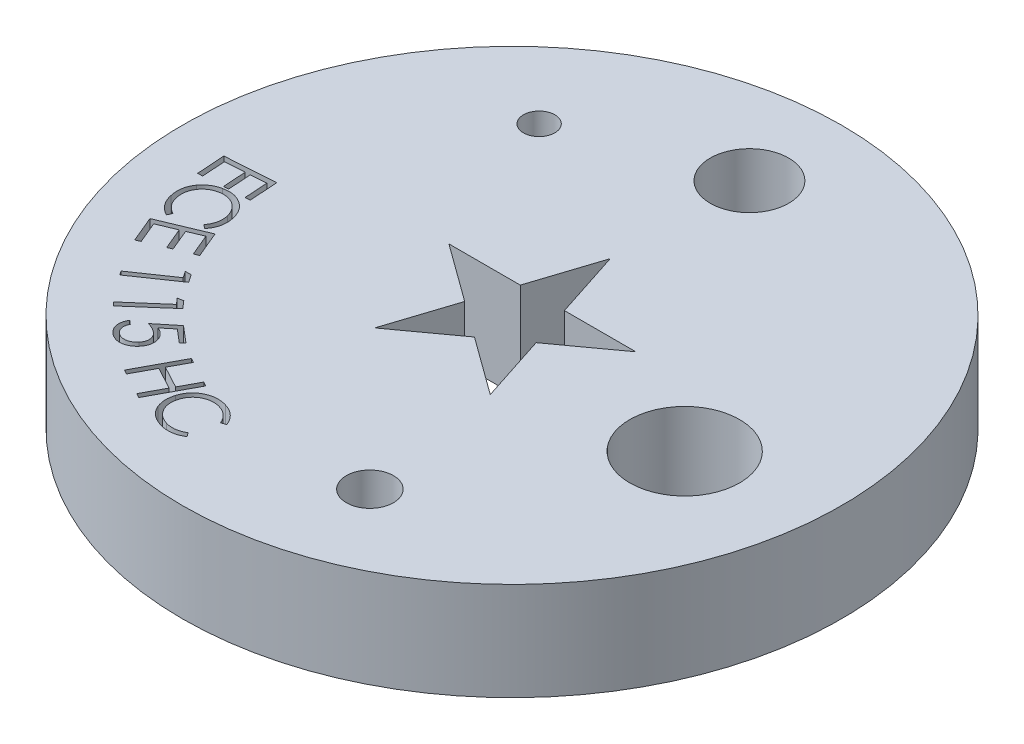
from build123d import *

# Parameters (mm, degrees)
SKETCH1_R           = 21
BOSS_EXTRUDE1_DEPTH = 6.25
CUT_EXTRUDE1_DEPTH  = 31.349011516
SKETCH3_R           = 1
CUT_EXTRUDE2_DEPTH  = 31.349011516
SKETCH5_R           = 2.5
CUT_EXTRUDE3_DEPTH  = 31.349011516
SKETCH6_R           = 3.5
CUT_EXTRUDE4_DEPTH  = 31.349011516
SKETCH7_R           = 1.5
CUT_EXTRUDE5_DEPTH  = 31.349011516
CUT_EXTRUDE6_DEPTH  = 31.349011516


with BuildPart() as part:
    # Sketch1 → Boss-Extrude1 (new body)
    with BuildSketch(Plane(origin=(0, 0, 0), x_dir=(1, 0, 0), z_dir=(0, 1, 0))):
        with Locations(Location((0, 0, 0), (0, 0, 270))):
            Circle(SKETCH1_R)
    extrude(amount=BOSS_EXTRUDE1_DEPTH)

    # Sketch2 → Cut-Extrude1 (cut, through all)
    with BuildSketch(Plane(origin=(0, 6.25, 0), x_dir=(1, 0, 0), z_dir=(0, 1, 0))):
        Polygon((0, 6.260990337), (-1.405679911, 1.934752416), (-5.954555658, 1.934752416), (-2.274437874, -0.739009663), (-3.680117785, -5.065247584), (0, -2.391485505), (3.680117785, -5.065247584), (2.274437874, -0.739009663), (5.954555658, 1.934752416), (1.405679911, 1.934752416), align=None)
    extrude(amount=-CUT_EXTRUDE1_DEPTH, mode=Mode.SUBTRACT)

    # Sketch3 → Cut-Extrude2 (cut, through all)
    with BuildSketch(Plane(origin=(0, 6.25, 0), x_dir=(1, 0, 0), z_dir=(0, 1, 0))):
        with Locations(Location((-9.706719743, 11.435890513, 0), (0, 0, 270))):
            Circle(SKETCH3_R)
    extrude(amount=-CUT_EXTRUDE2_DEPTH, mode=Mode.SUBTRACT)

    # Sketch5 → Cut-Extrude3 (cut, through all)
    with BuildSketch(Plane(origin=(0, 6.25, 0), x_dir=(1, 0, 0), z_dir=(0, 1, 0))):
        with Locations(Location((0.131567891, 15, 0), (0, 0, 270))):
            Circle(SKETCH5_R)
    extrude(amount=-CUT_EXTRUDE3_DEPTH, mode=Mode.SUBTRACT)

    # Sketch6 → Cut-Extrude4 (cut, through all)
    with BuildSketch(Plane(origin=(0, 6.25, 0), x_dir=(1, 0, 0), z_dir=(0, 1, 0))):
        with Locations(Location((13, -1.994916639, 0), (0, 0, 270))):
            Circle(SKETCH6_R)
    extrude(amount=-CUT_EXTRUDE4_DEPTH, mode=Mode.SUBTRACT)

    # Sketch7 → Cut-Extrude5 (cut, through all)
    with BuildSketch(Plane(origin=(0, 6.25, 0), x_dir=(1, 0, 0), z_dir=(0, 1, 0))):
        with Locations(Location((5.064482164, -14.119172086, 0), (0, 0, 270))):
            Circle(SKETCH7_R)
    extrude(amount=-CUT_EXTRUDE5_DEPTH, mode=Mode.SUBTRACT)

    # Sketch8 → Cut-Extrude6 (cut, through all)
    with BuildSketch(Plane(origin=(0, 6.25, 0), x_dir=(1, 0, 0), z_dir=(0, 1, 0))):
        Polygon((-14.816731771, -0.176812901), (-14.696524439, -1.986283053), (-15.008173077, -2.007271635), (-15.107391827, -0.513266226), (-16.094491186, -0.578776042), (-15.995908454, -2.05942508), (-16.305013021, -2.079777644), (-16.403595753, -0.599128606), (-17.642558093, -0.681810897), (-17.543975361, -2.162459936), (-17.854987981, -2.1828125), (-17.974559295, -0.386698718), align=None)
        with BuildLine():
            Line((-14.58696148, -5.001461761), (-14.829284196, -4.803024261))
            add(Edge.make_bspline(
                [(-14.829284196, -4.803024261), (-14.812098196, -4.781145379), (-14.777872061, -4.737573309), (-14.730947732, -4.669749255), (-14.688743726, -4.600051143), (-14.651269781, -4.528843323), (-14.618191342, -4.456208832), (-14.589145087, -4.38228198), (-14.565972037, -4.306189004), (-14.539487678, -4.203152787), (-14.51808037, -4.071046811), (-14.51245312, -3.909537234), (-14.522878977, -3.744821569), (-14.545546194, -3.635944172), (-14.557068651, -3.58059838)],
                knots=[0, 0, 0, 0, 0.770714165, 1.534886924, 2.283366767, 3.026944255, 3.762942943, 4.493790365, 5.225793501, 5.965183097, 7.440738967, 8.922129034, 10.435421736, 12, 12, 12, 12], degree=3))
            add(Edge.make_bspline(
                [(-14.557068651, -3.58059838), (-14.564729189, -3.550380779), (-14.579921014, -3.490455418), (-14.60956072, -3.403007698), (-14.643987282, -3.318604955), (-14.682424429, -3.236457128), (-14.72807114, -3.158600322), (-14.77778562, -3.083093006), (-14.832435917, -3.010509309), (-14.892250438, -2.941568418), (-14.955272676, -2.876069153), (-15.02238592, -2.816372175), (-15.091755269, -2.761454403), (-15.163817496, -2.711817448), (-15.238306758, -2.666836709), (-15.316189588, -2.628350687), (-15.396475999, -2.594144771), (-15.479828962, -2.566666143), (-15.564627115, -2.543456182), (-15.650998213, -2.527034396), (-15.738102669, -2.516256091), (-15.826276454, -2.510940477), (-15.91552953, -2.512463653), (-16.005981208, -2.51959631), (-16.09767074, -2.531872474), (-16.15843127, -2.545354899), (-16.189089885, -2.552157875)],
                knots=[0, 0, 0, 0, 1.042613934, 2.067636623, 3.085765015, 4.091464616, 5.098788632, 6.102059215, 7.114911589, 8.135803287, 9.154030498, 10.153608741, 11.138381355, 12.112263656, 13.079303243, 14.046758917, 15.016292351, 15.996456499, 16.98059034, 17.955711611, 18.934874399, 19.915320797, 20.908410745, 21.918602327, 22.949766082, 24, 24, 24, 24], degree=3))
            add(Edge.make_bspline(
                [(-16.189089885, -2.552157875), (-16.234736086, -2.563978931), (-16.324397443, -2.587198649), (-16.452301687, -2.636950201), (-16.571611099, -2.696713123), (-16.682761346, -2.767044094), (-16.784674059, -2.848790259), (-16.877942012, -2.941092194), (-16.963349864, -3.043345978), (-17.037989358, -3.156129449), (-17.102994023, -3.275185603), (-17.153746159, -3.39981298), (-17.193347573, -3.527091107), (-17.217734185, -3.658791588), (-17.230351271, -3.793619605), (-17.227319375, -3.931984513), (-17.214383345, -4.073973088), (-17.194143882, -4.168437671), (-17.183821456, -4.216616008)],
                knots=[0, 0, 0, 0, 1.042959323, 2.048651275, 3.030813715, 3.992860091, 4.954391304, 5.91670088, 6.893061504, 7.897833375, 8.905668915, 9.890417604, 10.8716379, 11.850892485, 12.849729314, 13.863447213, 14.910326419, 16, 16, 16, 16], degree=3))
            add(Edge.make_bspline(
                [(-17.183821456, -4.216616008), (-17.169875782, -4.268912296), (-17.142366573, -4.372071858), (-17.082488708, -4.518723642), (-17.009374727, -4.655459083), (-16.920459766, -4.78084072), (-16.818285941, -4.896852777), (-16.701113127, -5.001893129), (-16.570070513, -5.096992729), (-16.474418749, -5.149998534), (-16.425688443, -5.177002627)],
                knots=[0, 0, 0, 0, 1.02629743, 2.024472427, 2.998391252, 3.962839653, 4.934820147, 5.926201189, 6.943492049, 8, 8, 8, 8], degree=3))
            Line((-16.425688443, -5.177002627), (-16.552891968, -5.462574542))
            add(Edge.make_bspline(
                [(-16.552891968, -5.462574542), (-16.581250574, -5.448680546), (-16.637928757, -5.420911676), (-16.71975306, -5.373842346), (-16.798213636, -5.322340903), (-16.872835578, -5.265825382), (-16.945022228, -5.205570379), (-17.013322786, -5.140047842), (-17.078763908, -5.070407231), (-17.14005124, -4.996053823), (-17.198358727, -4.917864748), (-17.251181342, -4.835233321), (-17.300866863, -4.749599795), (-17.344947244, -4.659941448), (-17.385525416, -4.566702694), (-17.420360827, -4.469541743), (-17.453202373, -4.369355118), (-17.469857368, -4.30048876), (-17.478297618, -4.265589365)],
                knots=[0, 0, 0, 0, 0.966561829, 1.931793491, 2.887662159, 3.837851015, 4.79600856, 5.764638322, 6.733528983, 7.719934832, 8.712980354, 9.71753971, 10.720609321, 11.742319839, 12.774367917, 13.831817853, 14.901230632, 16, 16, 16, 16], degree=3))
            add(Edge.make_bspline(
                [(-17.478297618, -4.265589365), (-17.485555662, -4.232357933), (-17.499879419, -4.166775674), (-17.516589281, -4.068561181), (-17.527804299, -3.971946119), (-17.535165299, -3.877106135), (-17.536832091, -3.783903425), (-17.534568443, -3.692395558), (-17.526917956, -3.602342645), (-17.514036947, -3.51407266), (-17.49712764, -3.427327229), (-17.474586367, -3.342712653), (-17.447990061, -3.259556604), (-17.415840065, -3.178223742), (-17.38008052, -3.098016452), (-17.337963007, -3.020025352), (-17.292196704, -2.943256902), (-17.257700664, -2.894130404), (-17.240427025, -2.869530672)],
                knots=[0, 0, 0, 0, 1.115601783, 2.201640997, 3.266003115, 4.304938057, 5.320406242, 6.32213878, 7.306168156, 8.282699681, 9.246872703, 10.203215285, 11.153216507, 12.108800348, 13.070462499, 14.031722301, 15.014399397, 16, 16, 16, 16], degree=3))
            add(Edge.make_bspline(
                [(-17.240427025, -2.869530672), (-17.209589644, -2.829255522), (-17.148559458, -2.74954707), (-17.044158586, -2.641493186), (-16.931500437, -2.544082465), (-16.810321413, -2.457120215), (-16.679999064, -2.381721736), (-16.541325522, -2.31686712), (-16.393526817, -2.263004789), (-16.290887466, -2.236286154), (-16.23869926, -2.222700744)],
                knots=[0, 0, 0, 0, 0.998145678, 1.975427735, 2.952112238, 3.927529073, 4.907731214, 5.912472161, 6.938571511, 8, 8, 8, 8], degree=3))
            add(Edge.make_bspline(
                [(-16.23869926, -2.222700744), (-16.183327978, -2.211238267), (-16.074128666, -2.188632783), (-15.909569532, -2.173732145), (-15.748046115, -2.174650288), (-15.589909252, -2.192659573), (-15.434860717, -2.226413119), (-15.283342651, -2.277117214), (-15.135082377, -2.344372385), (-14.991876509, -2.427528977), (-14.85583172, -2.522982107), (-14.731714112, -2.631399959), (-14.619780276, -2.750029967), (-14.520723504, -2.879876826), (-14.434471845, -3.020862938), (-14.360736816, -3.172458033), (-14.299747797, -3.335024962), (-14.270073283, -3.44842867), (-14.254960278, -3.506184317)],
                knots=[0, 0, 0, 0, 1.028019536, 2.027387164, 2.999348136, 3.961928065, 4.91741177, 5.880933914, 6.863102977, 7.873940528, 8.889468936, 9.881793547, 10.866775641, 11.851855894, 12.847383298, 13.868542882, 14.914465066, 16, 16, 16, 16], degree=3))
            add(Edge.make_bspline(
                [(-14.254960278, -3.506184317), (-14.247096188, -3.541718061), (-14.231584488, -3.611807393), (-14.216221681, -3.717482148), (-14.204928377, -3.821403801), (-14.200460447, -3.924437389), (-14.202481491, -4.025946882), (-14.210066928, -4.126186231), (-14.223483109, -4.224930228), (-14.242361325, -4.322048693), (-14.267409046, -4.416873407), (-14.297090403, -4.509425544), (-14.332808619, -4.598672047), (-14.373090124, -4.685457621), (-14.418717853, -4.768847573), (-14.469272953, -4.849689828), (-14.525234659, -4.927399405), (-14.566309288, -4.976682419), (-14.58696148, -5.001461761)],
                knots=[0, 0, 0, 0, 1.096927428, 2.163659172, 3.217578304, 4.247676424, 5.27058997, 6.277074629, 7.276899891, 8.273512016, 9.258017796, 10.232344515, 11.20211057, 12.154381245, 13.115492564, 14.066109897, 15.027646242, 16, 16, 16, 16], degree=3))
        make_face()
        Polygon((-13.95398022, -4.969806986), (-13.253088794, -6.645077418), (-13.541204779, -6.765920768), (-14.119980821, -5.382582426), (-15.03457417, -5.765465038), (-14.46088627, -7.136719045), (-14.747094202, -7.256290359), (-15.320782103, -5.885036353), (-16.467521887, -6.364593644), (-15.893833986, -7.735847651), (-16.181949971, -7.856691), (-16.877753257, -6.193504902), align=None)
        Polygon((-12.476421438, -7.967903927), (-12.124703689, -8.4792621), (-14.726651806, -10.267107653), (-14.904100725, -10.008884496), (-12.556559659, -8.395943791), (-12.83767945, -7.986984456), align=None)
        Polygon((-11.265487027, -9.651104548), (-10.859071762, -10.116669452), (-13.226965392, -12.18181869), (-13.432399086, -11.946492168), (-11.296015873, -10.083596535), (-11.619748846, -9.71216224), align=None)
        with BuildLine():
            Line((-8.866634645, -11.90900366), (-9.059347987, -12.136697971))
            Line((-9.059347987, -12.136697971), (-9.912883644, -11.415453981))
            Line((-9.912883644, -11.415453981), (-10.583882242, -11.968789317))
            add(Edge.make_bspline(
                [(-10.583882242, -11.968789317), (-10.552542126, -11.983273431), (-10.491998321, -12.011254291), (-10.406916059, -12.057686441), (-10.330935365, -12.107013713), (-10.285329791, -12.143341752), (-10.263329357, -12.160866641)],
                knots=[0, 0, 0, 0, 1.104904017, 2.134487752, 3.100064437, 4, 4, 4, 4], degree=3))
            add(Edge.make_bspline(
                [(-10.263329357, -12.160866641), (-10.237235207, -12.184154484), (-10.185931548, -12.229940667), (-10.117749297, -12.305355689), (-10.058796042, -12.384487519), (-10.009410786, -12.467578239), (-9.970063953, -12.554547794), (-9.938958376, -12.644924222), (-9.918111152, -12.739456828), (-9.906915848, -12.836841263), (-9.904740693, -12.935276066), (-9.913174154, -13.032871178), (-9.931115225, -13.128713437), (-9.958290713, -13.222973379), (-9.997237791, -13.314844479), (-10.045073785, -13.405281236), (-10.102321389, -13.494399211), (-10.147450062, -13.550123998), (-10.170470783, -13.578549934)],
                knots=[0, 0, 0, 0, 1.053664194, 2.071607201, 3.058319812, 4.023883661, 4.979050283, 5.930897556, 6.899923429, 7.890766291, 8.881485496, 9.862761175, 10.837899776, 11.816675174, 12.813599404, 13.839853266, 14.898081142, 16, 16, 16, 16], degree=3))
            add(Edge.make_bspline(
                [(-10.170470783, -13.578549934), (-10.187175757, -13.597865577), (-10.220262886, -13.636123593), (-10.273953565, -13.688916984), (-10.330148859, -13.737430756), (-10.388688727, -13.781854818), (-10.44930733, -13.822811181), (-10.512268247, -13.859816225), (-10.577944517, -13.89235663), (-10.667849127, -13.92897516), (-10.781894307, -13.965241073), (-10.921189703, -13.987048484), (-11.060294115, -13.991796114), (-11.175247027, -13.977338175), (-11.266121817, -13.957122705), (-11.333553705, -13.936809362), (-11.399885669, -13.91104896), (-11.46545347, -13.881019849), (-11.530695637, -13.846957527), (-11.593988609, -13.806492682), (-11.656649729, -13.761938857), (-11.696872955, -13.729298121), (-11.717265655, -13.712749654)],
                knots=[0, 0, 0, 0, 0.880634493, 1.74425103, 2.594605574, 3.440039992, 4.277752806, 5.116869038, 5.957418162, 6.803516571, 8.46441831, 10.071907971, 11.652183915, 13.250514396, 14.052477215, 14.862238344, 15.677135014, 16.505118785, 17.34916029, 18.21351967, 19.094275621, 20, 20, 20, 20], degree=3))
            add(Edge.make_bspline(
                [(-11.717265655, -13.712749654), (-11.740829202, -13.692229925), (-11.78715981, -13.651884065), (-11.847815159, -13.584242215), (-11.902523363, -13.515019401), (-11.949177153, -13.442155922), (-11.988152851, -13.365837246), (-12.020199585, -13.286571556), (-12.04347576, -13.203720373), (-12.06029617, -13.118904207), (-12.068251779, -13.032815203), (-12.068956008, -12.947070107), (-12.062204919, -12.862031289), (-12.046366743, -12.778144276), (-12.024724251, -12.694708628), (-11.99246802, -12.613372992), (-11.954996454, -12.531928867), (-11.923447134, -12.480282711), (-11.907434926, -12.454070768)],
                knots=[0, 0, 0, 0, 1.072205885, 2.108169492, 3.114668621, 4.100381676, 5.074107217, 6.054426452, 7.031630761, 8.02556638, 9.020381812, 9.996147198, 10.96791046, 11.944843436, 12.925162671, 13.923170887, 14.945948122, 16, 16, 16, 16], degree=3))
            Line((-11.907434926, -12.454070768), (-11.661296104, -12.662048532))
            add(Edge.make_bspline(
                [(-11.661296104, -12.662048532), (-11.675244923, -12.688269943), (-11.702093276, -12.738740286), (-11.731514121, -12.816525506), (-11.750974218, -12.891802439), (-11.76039104, -12.965376301), (-11.758688542, -13.037866147), (-11.748540595, -13.110058813), (-11.728862951, -13.182684321), (-11.701418722, -13.254941729), (-11.665218398, -13.324654166), (-11.621801533, -13.389565172), (-11.572212053, -13.449678571), (-11.533707411, -13.484240083), (-11.514376032, -13.501591801)],
                knots=[0, 0, 0, 0, 1.148567932, 2.21073607, 3.209764479, 4.152197417, 5.071338948, 6.007787669, 6.967107686, 7.977427939, 8.993992997, 9.999871966, 10.995829289, 12, 12, 12, 12], degree=3))
            add(Edge.make_bspline(
                [(-11.514376032, -13.501591801), (-11.494563014, -13.517521155), (-11.455519759, -13.548911316), (-11.391712575, -13.587788707), (-11.325714504, -13.619651174), (-11.256900122, -13.644281779), (-11.185337007, -13.660503143), (-11.111232883, -13.670324797), (-11.034532341, -13.671802404), (-10.956163606, -13.666964613), (-10.87801828, -13.654257976), (-10.801678837, -13.634555205), (-10.728260296, -13.607217076), (-10.658306134, -13.571811012), (-10.590777355, -13.530266918), (-10.526438713, -13.48106825), (-10.465143671, -13.424171771), (-10.427509354, -13.381917109), (-10.408341376, -13.360395888)],
                knots=[0, 0, 0, 0, 0.981584939, 1.934297478, 2.879725148, 3.810015263, 4.752028798, 5.710326258, 6.693789961, 7.711830479, 8.740888505, 9.748390772, 10.75429277, 11.76189497, 12.773652248, 13.814191815, 14.886720246, 16, 16, 16, 16], degree=3))
            add(Edge.make_bspline(
                [(-10.408341376, -13.360395888), (-10.392050208, -13.34033369), (-10.359994503, -13.30085783), (-10.31953846, -13.23786179), (-10.286043567, -13.173801372), (-10.259829255, -13.108611465), (-10.240494237, -13.042403713), (-10.229030805, -12.974742278), (-10.224679766, -12.906121233), (-10.22704262, -12.83659985), (-10.237369417, -12.767566175), (-10.254405823, -12.699921438), (-10.279099695, -12.634427329), (-10.310042931, -12.570608926), (-10.349386015, -12.509173814), (-10.395976007, -12.450324974), (-10.449222226, -12.392921313), (-10.489009187, -12.357699253), (-10.509468179, -12.339587595)],
                knots=[0, 0, 0, 0, 1.072940383, 2.111196594, 3.103887976, 4.07209301, 5.025402004, 5.96366115, 6.916848085, 7.877492671, 8.847778492, 9.811164558, 10.769828806, 11.750610526, 12.752363864, 13.793641466, 14.86546068, 16, 16, 16, 16], degree=3))
            add(Edge.make_bspline(
                [(-10.509468179, -12.339587595), (-10.527899504, -12.324655678), (-10.565804929, -12.293947053), (-10.628666708, -12.252529089), (-10.697019934, -12.211442352), (-10.771697975, -12.172210277), (-10.852909471, -12.135625871), (-10.939794033, -12.099763892), (-11.032908072, -12.065507899), (-11.09770121, -12.04486341), (-11.130857402, -12.034299133)],
                knots=[0, 0, 0, 0, 0.816708748, 1.679623848, 2.590209332, 3.563728781, 4.583410659, 5.657582335, 6.801329071, 8, 8, 8, 8], degree=3))
            Line((-11.130857402, -12.034299133), (-9.904615415, -11.031935351))
            Line((-9.904615415, -11.031935351), (-8.866634645, -11.90900366))
        make_face()
        Polygon((-7.83299081, -12.589416984), (-7.553143053, -12.739517144), (-8.180256435, -13.904701439), (-6.7682973, -14.664742505), (-6.141183919, -13.49955821), (-5.861336162, -13.650294388), (-7.356613606, -16.42778337), (-7.636461363, -16.277047193), (-6.914581355, -14.936322032), (-8.326540489, -14.176280967), (-9.048420497, -15.517006127), (-9.328268254, -15.366905967), align=None)
        with BuildLine():
            Line((-3.067357344, -15.113517951), (-3.361833506, -15.221640947))
            add(Edge.make_bspline(
                [(-3.361833506, -15.221640947), (-3.371899831, -15.195640147), (-3.391864816, -15.144071612), (-3.427209071, -15.06976354), (-3.465439985, -14.998128706), (-3.507102997, -14.929472387), (-3.553446641, -14.864384389), (-3.602631613, -14.801934321), (-3.656636291, -14.743512147), (-3.731871906, -14.668679436), (-3.834793991, -14.58321714), (-3.971150763, -14.496218854), (-4.118927727, -14.422379016), (-4.224208969, -14.386811824), (-4.277698891, -14.368741308)],
                knots=[0, 0, 0, 0, 0.772676205, 1.532482776, 2.279221066, 3.023086027, 3.756852805, 4.492969447, 5.225134009, 5.960710848, 7.434081558, 8.922484614, 10.436416088, 12, 12, 12, 12], degree=3))
            add(Edge.make_bspline(
                [(-4.277698891, -14.368741308), (-4.307708026, -14.360100384), (-4.367094132, -14.343000564), (-4.457410674, -14.324013177), (-4.547432669, -14.310446724), (-4.637771958, -14.303561344), (-4.72804304, -14.302323686), (-4.818379269, -14.306533527), (-4.908625597, -14.317687337), (-4.998209619, -14.334167185), (-5.086739502, -14.35546862), (-5.172157588, -14.38305142), (-5.254927852, -14.414549255), (-5.333728077, -14.452700132), (-5.41021149, -14.494190064), (-5.483227856, -14.541783427), (-5.552839451, -14.594377828), (-5.619153898, -14.651729736), (-5.681362957, -14.713385891), (-5.73965, -14.779043961), (-5.792668999, -14.849124869), (-5.84234234, -14.922344317), (-5.885771488, -15.000464147), (-5.926184016, -15.081670037), (-5.961227794, -15.167205377), (-5.980669094, -15.226180816), (-5.990494363, -15.255985899)],
                knots=[0, 0, 0, 0, 1.044566202, 2.067127798, 3.085350008, 4.088562585, 5.095929476, 6.104419589, 7.111836428, 8.135848588, 9.15090323, 10.155919787, 11.137302872, 12.111378231, 13.082841464, 14.046921782, 15.024400485, 15.999998503, 16.978094723, 17.953022032, 18.934789576, 19.916505868, 20.910725359, 21.922701965, 22.950172434, 24, 24, 24, 24], degree=3))
            add(Edge.make_bspline(
                [(-5.990494363, -15.255985899), (-6.003256261, -15.301360152), (-6.028360528, -15.390617043), (-6.050186897, -15.525999137), (-6.059731673, -15.659104387), (-6.054372594, -15.790431026), (-6.035944225, -15.919797728), (-6.004141295, -16.047205863), (-5.957485724, -16.171993584), (-5.898923299, -16.293674998), (-5.828755302, -16.409800811), (-5.747586077, -16.517068347), (-5.656838768, -16.614894441), (-5.556383846, -16.703301645), (-5.445768777, -16.781587659), (-5.325742229, -16.85050882), (-5.195877132, -16.909349271), (-5.10460054, -16.940293867), (-5.05809252, -16.95606102)],
                knots=[0, 0, 0, 0, 1.042786897, 2.051293682, 3.029765793, 3.992680665, 4.955149311, 5.918201442, 6.893843915, 7.899386508, 8.903964678, 9.892438315, 10.872181659, 11.853273181, 12.84957184, 13.867200847, 14.913278165, 16, 16, 16, 16], degree=3))
            add(Edge.make_bspline(
                [(-5.05809252, -16.95606102), (-5.005986856, -16.970558325), (-4.903263028, -16.99913907), (-4.746556453, -17.021777673), (-4.591501673, -17.026960356), (-4.438004694, -17.015062366), (-4.286375771, -16.984661258), (-4.136653315, -16.937217508), (-3.98865587, -16.872058713), (-3.894499578, -16.816491959), (-3.846478939, -16.788152366)],
                knots=[0, 0, 0, 0, 1.025883522, 2.022480345, 2.996947989, 3.965856608, 4.938244383, 5.92595228, 6.942215168, 8, 8, 8, 8], degree=3))
            Line((-3.846478939, -16.788152366), (-3.664577897, -17.041923399))
            add(Edge.make_bspline(
                [(-3.664577897, -17.041923399), (-3.690863393, -17.059442133), (-3.743306115, -17.094394112), (-3.825557143, -17.140469427), (-3.909723742, -17.182151706), (-3.996250315, -17.218283235), (-4.084980894, -17.249583208), (-4.175814704, -17.275818895), (-4.269211052, -17.295827764), (-4.364211022, -17.312008939), (-4.461084506, -17.322167315), (-4.558976964, -17.326300835), (-4.657745848, -17.326190153), (-4.757261405, -17.318521014), (-4.85801859, -17.30696021), (-4.959539049, -17.287927482), (-5.062419574, -17.264781287), (-5.130486078, -17.244768063), (-5.164943482, -17.234636741)],
                knots=[0, 0, 0, 0, 0.967147322, 1.929575118, 2.884946107, 3.842432995, 4.799413375, 5.76533933, 6.735837484, 7.723239478, 8.715645859, 9.716618111, 10.723071961, 11.738513022, 12.771816417, 13.827641724, 14.900283968, 16, 16, 16, 16], degree=3))
            add(Edge.make_bspline(
                [(-5.164943482, -17.234636741), (-5.197268967, -17.224112881), (-5.261122235, -17.203324861), (-5.35402023, -17.167508383), (-5.443198916, -17.128782324), (-5.528519002, -17.086750887), (-5.610225816, -17.041654777), (-5.687721868, -16.99277771), (-5.761111292, -16.940171527), (-5.831125016, -16.885223997), (-5.896989268, -16.826182685), (-5.959003128, -16.76419992), (-6.01739943, -16.698961153), (-6.071323837, -16.630179184), (-6.121693444, -16.558224991), (-6.168085794, -16.483002826), (-6.211151913, -16.404620201), (-6.23611821, -16.350100817), (-6.24871752, -16.322587462)],
                knots=[0, 0, 0, 0, 1.114775878, 2.202042241, 3.263865766, 4.302465027, 5.320210487, 6.323314807, 7.305377751, 8.280524323, 9.240783051, 10.204434175, 11.154875497, 12.110491121, 13.069162622, 14.033941894, 15.007823411, 16, 16, 16, 16], degree=3))
            add(Edge.make_bspline(
                [(-6.24871752, -16.322587462), (-6.267638736, -16.275625358), (-6.305182807, -16.182441673), (-6.345326659, -16.037852368), (-6.373595593, -15.89155973), (-6.385402566, -15.743008091), (-6.386205756, -15.592499537), (-6.370582674, -15.440007063), (-6.343260972, -15.285176069), (-6.314278898, -15.183053468), (-6.299598931, -15.131326444)],
                knots=[0, 0, 0, 0, 0.996489984, 1.977266789, 2.950172479, 3.926646771, 4.907894545, 5.910454788, 6.941605953, 8, 8, 8, 8], degree=3))
            add(Edge.make_bspline(
                [(-6.299598931, -15.131326444), (-6.281569136, -15.07770688), (-6.246056052, -14.972093028), (-6.175396925, -14.822779552), (-6.092377644, -14.684586135), (-5.997096468, -14.557391009), (-5.889862903, -14.440555047), (-5.768720542, -14.336211668), (-5.63575007, -14.242410393), (-5.492169367, -14.160055999), (-5.340578064, -14.092068609), (-5.184654832, -14.038550093), (-5.025607869, -14.002217261), (-4.863642572, -13.982383438), (-4.698676369, -13.979245418), (-4.530771498, -13.993295384), (-4.35957524, -14.021887185), (-4.246695954, -14.054078502), (-4.18929244, -14.07044904)],
                knots=[0, 0, 0, 0, 1.028896386, 2.026605597, 2.999379845, 3.95863701, 4.91436431, 5.879925754, 6.86272718, 7.872105294, 8.887623168, 9.882111217, 10.86776421, 11.851300119, 12.847015082, 13.865066244, 14.914303035, 16, 16, 16, 16], degree=3))
            add(Edge.make_bspline(
                [(-4.18929244, -14.07044904), (-4.154840351, -14.081802398), (-4.086657026, -14.104271563), (-3.987097187, -14.14306353), (-3.891775282, -14.186892694), (-3.800877218, -14.235423896), (-3.713748927, -14.287341746), (-3.631926529, -14.345107641), (-3.553076586, -14.406061588), (-3.479238435, -14.472043845), (-3.409726714, -14.5414108), (-3.34529594, -14.614006055), (-3.286173949, -14.690075683), (-3.231234701, -14.768370067), (-3.182951688, -14.850645485), (-3.138868329, -14.935188224), (-3.099925464, -15.022916224), (-3.078229828, -15.083271629), (-3.067357344, -15.113517951)],
                knots=[0, 0, 0, 0, 1.093245375, 2.163616347, 3.218694421, 4.253530245, 5.268343773, 6.273473994, 7.270527801, 8.270852656, 9.255895686, 10.229157351, 11.194266314, 12.158571038, 13.109829612, 14.067292345, 15.031448846, 16, 16, 16, 16], degree=3))
        make_face()
    extrude(amount=-CUT_EXTRUDE6_DEPTH, mode=Mode.SUBTRACT)


solid = part.part
